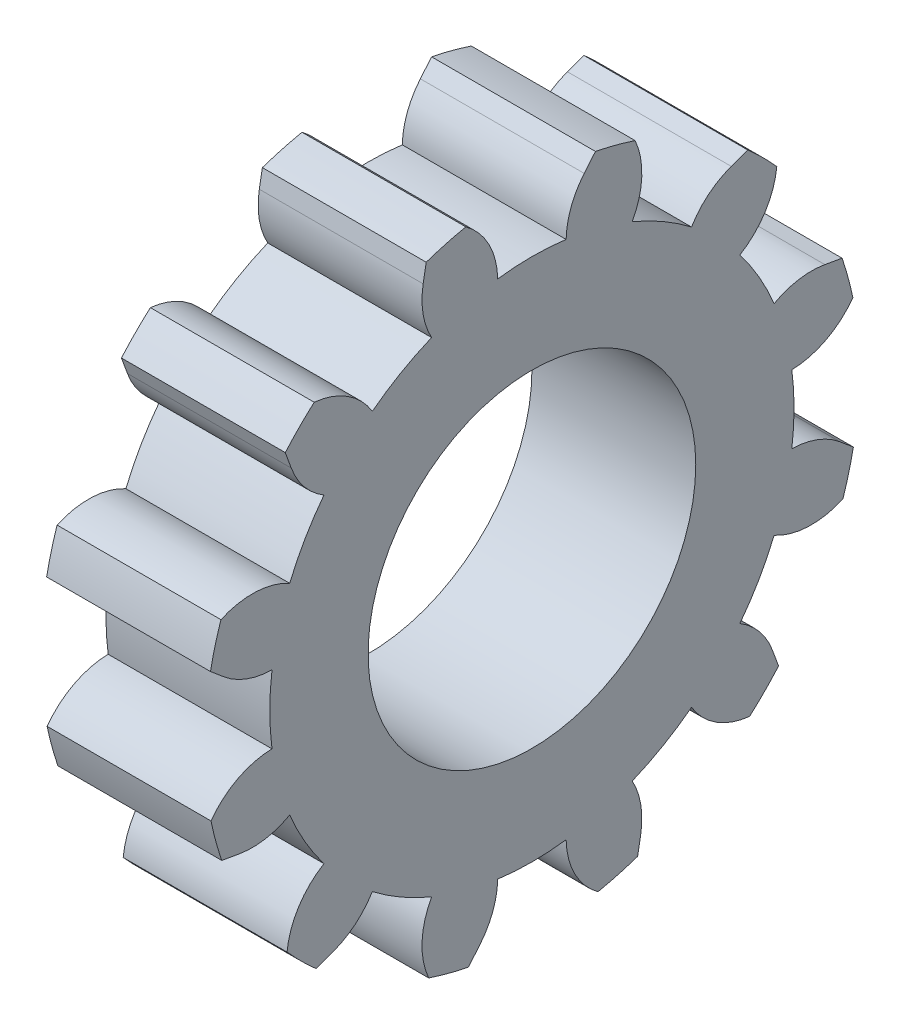
from build123d import *

# Parameters (mm, degrees)
SKETCH3_R           = 10
BOSS_EXTRUDE1_DEPTH = 5
CUT_EXTRUDE1_DEPTH  = 5
CIRPATTERN1_COUNT   = 12
SKETCH3_3_R         = 5
CUT_EXTRUDE3_DEPTH  = 5


with BuildPart() as part:
    # Sketch3 → Boss-Extrude1 (new body)
    with BuildSketch(Plane(origin=(0, 0, 0), x_dir=(0, 0, -1), z_dir=(1, 0, 0))):
        Circle(SKETCH3_R)
    extrude(amount=BOSS_EXTRUDE1_DEPTH)

    # Gear_Profile → Cut-Extrude1 (cut)
    with BuildSketch(Plane.ZY):
        with BuildLine():
            ThreePointArc((-1.595423995, 9.401352278), (-1.193917878, 8.71367126), (-1.044209538, 7.931558891))
            ThreePointArc((-1.044209538, 7.931558891), (0, 8), (1.044209538, 7.931558891))
            ThreePointArc((1.044209538, 7.931558891), (1.311715504, 8.977395553), (2.017271047, 9.794417671))
            ThreePointArc((2.017271047, 9.794417671), (0.040143535, 9.999919425), (-1.938570153, 9.810297945))
            Line((-1.938570153, 9.810297945), (-1.595423995, 9.401352278))
        make_face()
    cut_extrude1 = extrude(amount=-CUT_EXTRUDE1_DEPTH, mode=Mode.SUBTRACT)

    # CirPattern1: Cut-Extrude1 ×12 about axis
    cirpattern1_axis = Axis((5, 0, 0), (-1, 0, 0))
    for i in range(1, CIRPATTERN1_COUNT):
        add(cut_extrude1.rotate(cirpattern1_axis, i * 360 / CIRPATTERN1_COUNT), mode=Mode.SUBTRACT)

    # Sketch3<3> → Cut-Extrude3 (cut)
    with BuildSketch(Plane(origin=(0, 0, 0), x_dir=(0, 0, -1), z_dir=(1, 0, 0))):
        Circle(SKETCH3_3_R)
    extrude(amount=CUT_EXTRUDE3_DEPTH, mode=Mode.SUBTRACT)


solid = part.part
